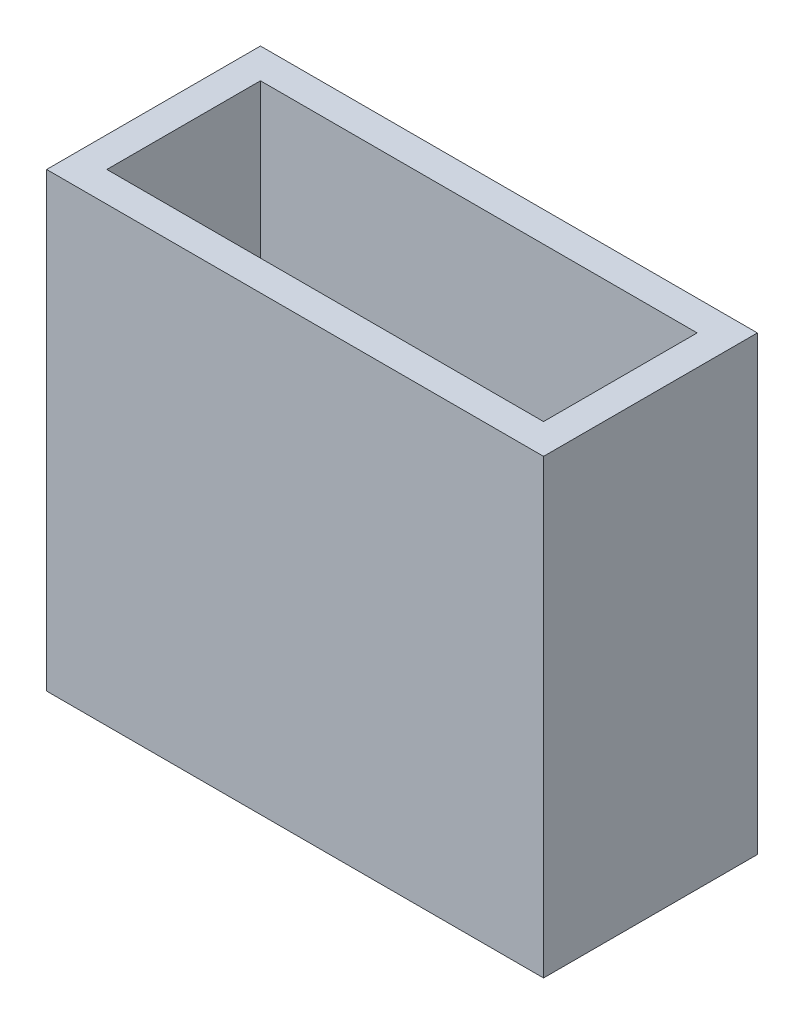
from build123d import *

# Parameters (mm, degrees)
SKETCH1_W               = 33
SKETCH1_H               = 14.2
SKETCH1_W_2             = 29
SKETCH1_H_2             = 10.2
BOSS_EXTRUDE1_DEPTH     = 30
BOSS_EXTRUDE2_START     = -14
SKETCH4_W               = 29
SKETCH4_H               = 10.2
BOSS_EXTRUDE2_DEPTH     = 2
CUT_EXTRUDE1_DEPTH      = 25.055352835
CUT_EXTRUDE1_DEPTH_BACK = 25.055352835
SKETCH5_W               = 0.6
SKETCH5_H               = 0.6


with BuildPart() as part:
    # Sketch1 → Boss-Extrude1 (new body)
    with BuildSketch(Plane(origin=(0, 0, 0), x_dir=(1, 0, 0), z_dir=(0, 1, 0))):
        Rectangle(SKETCH1_W, SKETCH1_H)
        Rectangle(SKETCH1_W_2, SKETCH1_H_2, mode=Mode.SUBTRACT)
    extrude(amount=BOSS_EXTRUDE1_DEPTH)

    # Sketch4 → Boss-Extrude2 (add)
    with BuildSketch(Plane(origin=(0, 30, 0), x_dir=(1, 0, 0), z_dir=(0, 1, 0)).offset(BOSS_EXTRUDE2_START)):
        Rectangle(SKETCH4_W, SKETCH4_H)
    extrude(amount=-BOSS_EXTRUDE2_DEPTH)

    # Sketch5 → Cut-Extrude1 (cut, two sides: drawn at the far end of the back side and taken through both)
    with BuildSketch(Plane(origin=(0, 16, 0), x_dir=(1, 0, 0), z_dir=(0, 1, 0)).offset(-CUT_EXTRUDE1_DEPTH_BACK)):
        with Locations((-10.125, -0.25)):
            Rectangle(SKETCH5_W, SKETCH5_H)
        with Locations((-12.375, -3)):
            Rectangle(SKETCH5_W, SKETCH5_H)
        with Locations((-12.375, -0.25)):
            Rectangle(SKETCH5_W, SKETCH5_H)
        with Locations((-10.125, -3)):
            Rectangle(SKETCH5_W, SKETCH5_H)
        with Locations((-7.875, -0.25)):
            Rectangle(SKETCH5_W, SKETCH5_H)
        with Locations((-7.875, -3)):
            Rectangle(SKETCH5_W, SKETCH5_H)
        with Locations((-5.625, -0.25)):
            Rectangle(SKETCH5_W, SKETCH5_H)
        with Locations((-5.625, -3)):
            Rectangle(SKETCH5_W, SKETCH5_H)
        with Locations((-3.375, -0.25)):
            Rectangle(SKETCH5_W, SKETCH5_H)
        with Locations((-3.375, -3)):
            Rectangle(SKETCH5_W, SKETCH5_H)
        with Locations((-1.125, -0.25)):
            Rectangle(SKETCH5_W, SKETCH5_H)
        with Locations((-1.125, -3)):
            Rectangle(SKETCH5_W, SKETCH5_H)
        with Locations((1.125, -0.25)):
            Rectangle(SKETCH5_W, SKETCH5_H)
        with Locations((1.125, -3)):
            Rectangle(SKETCH5_W, SKETCH5_H)
        with Locations((3.375, -0.25)):
            Rectangle(SKETCH5_W, SKETCH5_H)
        with Locations((3.375, -3)):
            Rectangle(SKETCH5_W, SKETCH5_H)
        with Locations((5.625, -0.25)):
            Rectangle(SKETCH5_W, SKETCH5_H)
        with Locations((5.625, -3)):
            Rectangle(SKETCH5_W, SKETCH5_H)
        with Locations((7.875, -0.25)):
            Rectangle(SKETCH5_W, SKETCH5_H)
        with Locations((7.875, -3)):
            Rectangle(SKETCH5_W, SKETCH5_H)
        with Locations((10.125, -0.25)):
            Rectangle(SKETCH5_W, SKETCH5_H)
        with Locations((10.125, -3)):
            Rectangle(SKETCH5_W, SKETCH5_H)
        with Locations((12.375, -0.25)):
            Rectangle(SKETCH5_W, SKETCH5_H)
        with Locations((12.375, -3)):
            Rectangle(SKETCH5_W, SKETCH5_H)
    extrude(amount=CUT_EXTRUDE1_DEPTH + CUT_EXTRUDE1_DEPTH_BACK, mode=Mode.SUBTRACT)


solid = part.part
